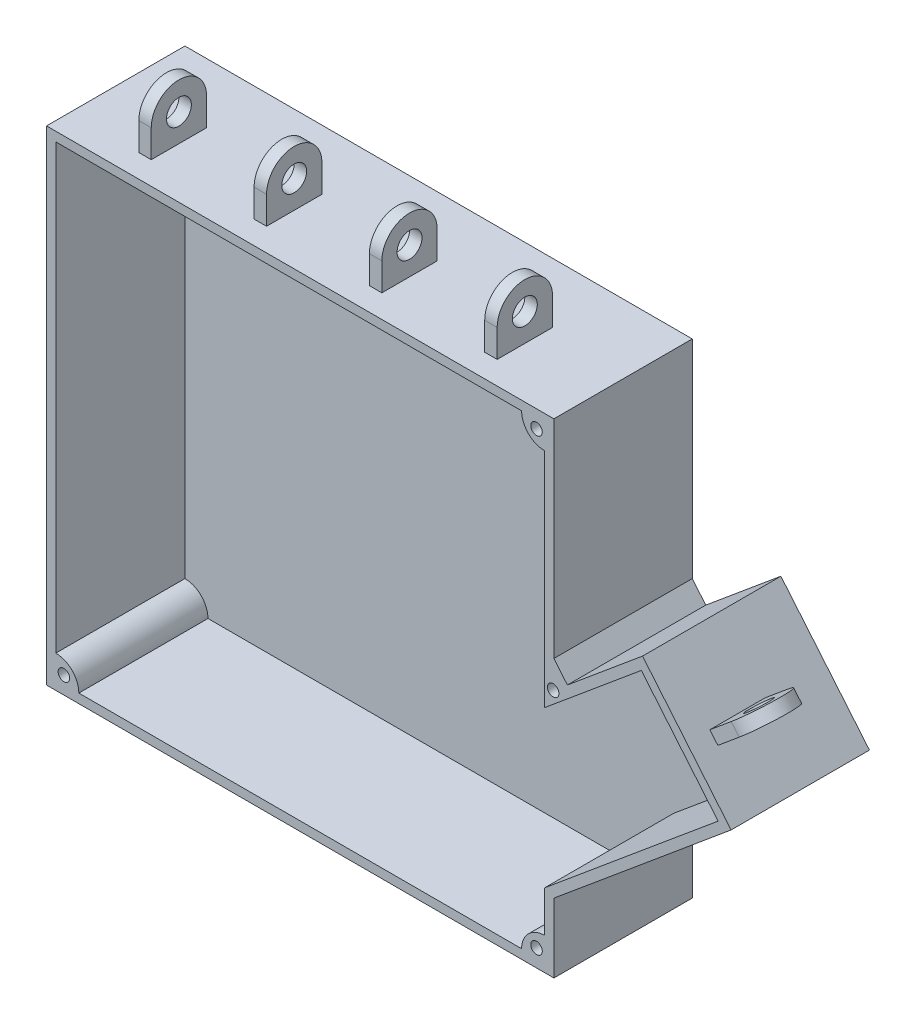
from build123d import *

# Parameters (mm, degrees)
BOSS_EXTRUDE1_DEPTH  = 30
SHELL1_T             = -2
BOSS_EXTRUDE8_START  = -28
SKETCH10_R           = 1.25
BOSS_EXTRUDE8_DEPTH  = 28
BOSS_EXTRUDE10_START = 10
SKETCH4_R            = 2.7
BOSS_EXTRUDE10_DEPTH = 2.7
LPATTERN1_COUNT      = 4
LPATTERN1_PITCH      = 25
SKETCH15_R           = 2.7
BOSS_EXTRUDE11_DEPTH = 2.7


with BuildPart() as part:
    # Sketch3 → Boss-Extrude1 (new body)
    with BuildSketch(Plane.XY):
        Polygon((-5, -5), (105, -5), (105, 10), (143.418246447, 42.000599056), (124.217887014, 65.051546924), (107.928964784, 51.483637987), (105, 55), (105, 100), (-5, 100), align=None)
    extrude(amount=BOSS_EXTRUDE1_DEPTH)

    # Shell1
    shell1_openings = [part.faces().sort_by_distance(p)[0] for p in [
        (56.242959197, 46.819948693, 30),
    ]]
    offset(amount=SHELL1_T, openings=shell1_openings, kind=Kind.INTERSECTION)

    # Sketch10 → Boss-Extrude8 (add)
    # profile 1 of 4: a face of its own
    with BuildSketch(Plane.XY.offset(30).offset(BOSS_EXTRUDE8_START)):
        with BuildLine():
            Line((98, 98), (103, 98))
            Line((103, 98), (103, 93))
            ThreePointArc((103, 93), (99.464466094, 94.464466094), (98, 98))
        make_face()
        with Locations(Location((101.232233047, 96.232233047, 0), (0, 0, 180))):
            Circle(SKETCH10_R, mode=Mode.SUBTRACT)
    # profile 2 of 4: a face of its own
    with BuildSketch(Plane.XY.offset(30).offset(BOSS_EXTRUDE8_START)):
        with BuildLine():
            Line((103, 2), (103, -3))
            Line((103, -3), (98, -3))
            ThreePointArc((98, -3), (99.464466094, 0.535533906), (103, 2))
        make_face()
        with Locations(Location((101.232233047, -1.232233047, 0), (0, 0, 180))):
            Circle(SKETCH10_R, mode=Mode.SUBTRACT)
    # profile 3 of 4: a face of its own
    with BuildSketch(Plane.XY.offset(30).offset(BOSS_EXTRUDE8_START)):
        with BuildLine():
            Line((-3, 2), (-3, -3))
            Line((-3, -3), (2, -3))
            ThreePointArc((2, -3), (0.535533906, 0.535533906), (-3, 2))
        make_face()
        with Locations(Location((-1.232233047, -1.232233047, 0), (0, 0, 180))):
            Circle(SKETCH10_R, mode=Mode.SUBTRACT)
    # profile 4 of 4: a face of its own
    with BuildSketch(Plane.XY.offset(30).offset(BOSS_EXTRUDE8_START)):
        Polygon((103, 54.276153954), (103, 44.775111449), (107.672258888, 48.666884167), align=None)
        with Locations(Location((104.838291581, 48.944255676, 0), (0, 0, 180))):
            Circle(SKETCH10_R, mode=Mode.SUBTRACT)
    extrude(amount=BOSS_EXTRUDE8_DEPTH)

    # Sketch4 → Boss-Extrude10 (add)
    with BuildSketch(Plane(origin=(0, 0, 0), x_dir=(0, 0, -1), z_dir=(1, 0, 0)).offset(BOSS_EXTRUDE10_START)):
        with BuildLine():
            Line((-25, 100), (-13, 100))
            Line((-13, 100), (-13, 106))
            ThreePointArc((-13, 106), (-19, 112), (-25, 106))
            Line((-25, 106), (-25, 100))
        make_face()
        with Locations(Location((-19, 106, 0), (0, 0, 180))):
            Circle(SKETCH4_R, mode=Mode.SUBTRACT)
    boss_extrude10 = extrude(amount=BOSS_EXTRUDE10_DEPTH)

    # LPattern1: Boss-Extrude10 ×4
    with Locations(*[(i * LPATTERN1_PITCH, 0, 0) for i in range(1, LPATTERN1_COUNT)]):
        add(boss_extrude10)

    # Sketch15 → Boss-Extrude11 (add)
    with BuildSketch(Plane(origin=(28.491802957, -34.205769267, 0), x_dir=(-0.7683649289406903, -0.6400119811175163, 0), z_dir=(0.6400119811175163, -0.7683649289406903, 0))):
        with BuildLine():
            Line((-137.07843735, -13), (-143.07843735, -13))
            ThreePointArc((-143.07843735, -13), (-149.07843735, -19), (-143.07843735, -25))
            Line((-143.07843735, -25), (-137.07843735, -25))
            Line((-137.07843735, -25), (-137.07843735, -13))
        make_face()
        with Locations(Location((-143.07843735, -19, 0), (0, 0, 180))):
            Circle(SKETCH15_R, mode=Mode.SUBTRACT)
    extrude(amount=BOSS_EXTRUDE11_DEPTH)


solid = part.part
